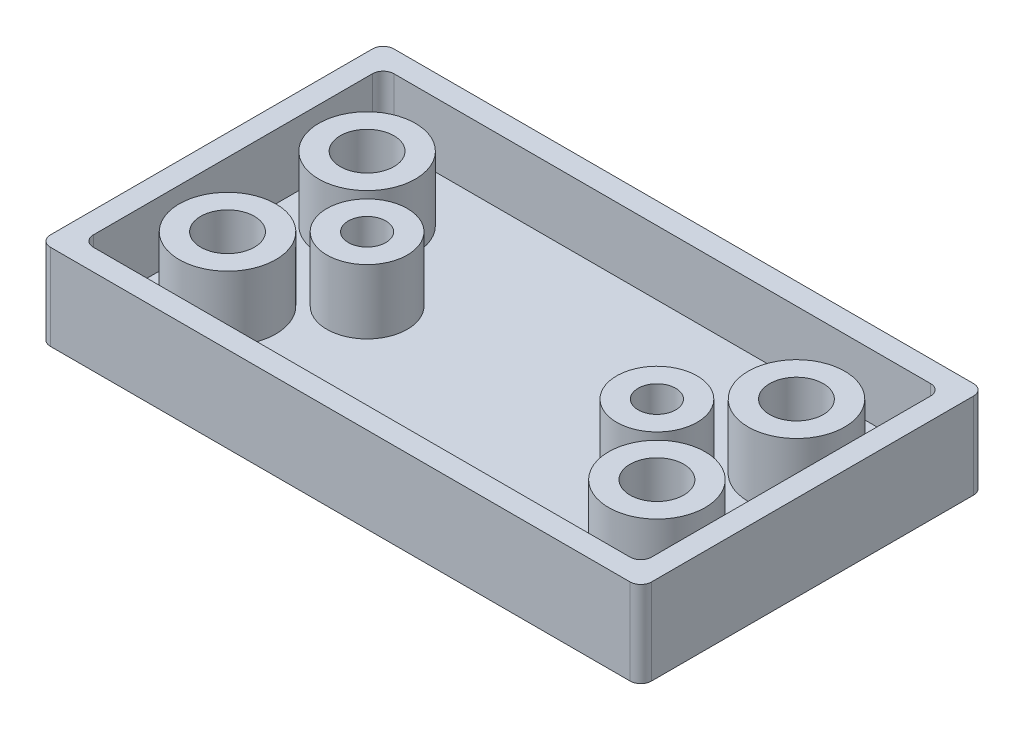
from build123d import *

# Parameters (mm, degrees)
SKETCH1_W                 = 56
SKETCH1_H                 = 32
SKETCH1_W_2               = 52
SKETCH1_H_2               = 28
BOSS_EXTRUDE1_DEPTH       = 8
SKETCH2_W                 = 56
SKETCH2_H                 = 32
BOSS_EXTRUDE2_DEPTH       = 2
SKETCH3_R                 = 3.75
SKETCH3_R_2               = 1.75
SKETCH3_R_3               = 4.5
SKETCH3_R_4               = 2.5
BOSS_EXTRUDE3_DEPTH       = 6
MIRROR2_COPY_1_SKETCH_R   = 3.75
MIRROR2_COPY_1_SKETCH_R_2 = 1.75
MIRROR2_COPY_1_SKETCH_R_3 = 4.5
MIRROR2_COPY_1_SKETCH_R_4 = 2.5
MIRROR2_COPY_1_DEPTH      = 6
FILLET1_R                 = 1


with BuildPart() as part:
    # Sketch1 → Boss-Extrude1 (new body)
    with BuildSketch(Plane(origin=(0, 0, 0), x_dir=(1, 0, 0), z_dir=(0, 1, 0))):
        Rectangle(SKETCH1_W, SKETCH1_H)
        Rectangle(SKETCH1_W_2, SKETCH1_H_2, mode=Mode.SUBTRACT)
    extrude(amount=BOSS_EXTRUDE1_DEPTH)

    # Sketch2 → Boss-Extrude2 (add)
    with BuildSketch(Plane(origin=(0, 0, 0), x_dir=(1, 0, 0), z_dir=(0, 1, 0))):
        Rectangle(SKETCH2_W, SKETCH2_H)
    extrude(amount=BOSS_EXTRUDE2_DEPTH)

    # Sketch3 → Boss-Extrude3 (add)
    # profile 1 of 2: a face of its own
    with BuildSketch(Plane(origin=(0, 2, 0), x_dir=(1, 0, 0), z_dir=(0, 1, 0))):
        with Locations(Location((13.5, 0, 0), (0, 0, 270))):
            Circle(SKETCH3_R)
        with Locations(Location((13.5, 0, 0), (0, 0, 270))):
            Circle(SKETCH3_R_2, mode=Mode.SUBTRACT)
    # profile 2 of 2: a face of its own
    with BuildSketch(Plane(origin=(0, 2, 0), x_dir=(1, 0, 0), z_dir=(0, 1, 0))):
        with Locations(Location((20, 6.5, 0), (0, 0, 270))):
            Circle(SKETCH3_R_3)
        with Locations(Location((20, 6.5, 0), (0, 0, 270))):
            Circle(SKETCH3_R_4, mode=Mode.SUBTRACT)
    boss_extrude3 = extrude(amount=BOSS_EXTRUDE3_DEPTH)

    # Mirror1: Boss-Extrude3 across plane
    add(boss_extrude3.mirror(Plane.XY))

    # Mirror2: Boss-Extrude3 across plane
    add(boss_extrude3.mirror(Plane(origin=(0, 0, 0), x_dir=(0, 0, 1), z_dir=(1, 0, 0))))

    # Mirror2 copy 1 sketch → Mirror2 copy 1 (add)
    # profile 1 of 2: a face of its own
    with BuildSketch(Plane(origin=(0, 2, 0), x_dir=(-1, 0, 0), z_dir=(0, 1, 0))):
        with Locations(Location((13.5, 0, 0), (0, 0, 270))):
            Circle(MIRROR2_COPY_1_SKETCH_R)
        with Locations(Location((13.5, 0, 0), (0, 0, 270))):
            Circle(MIRROR2_COPY_1_SKETCH_R_2, mode=Mode.SUBTRACT)
    # profile 2 of 2: a face of its own
    with BuildSketch(Plane(origin=(0, 2, 0), x_dir=(-1, 0, 0), z_dir=(0, 1, 0))):
        with Locations(Location((20, 6.5, 0), (0, 0, 270))):
            Circle(MIRROR2_COPY_1_SKETCH_R_3)
        with Locations(Location((20, 6.5, 0), (0, 0, 270))):
            Circle(MIRROR2_COPY_1_SKETCH_R_4, mode=Mode.SUBTRACT)
    extrude(amount=MIRROR2_COPY_1_DEPTH)

    # Fillet1
    fillet1_edges = [part.edges().sort_by_distance(p)[0] for p in [
        (26, 5, 14),
        (26, 5, -14),
        (-26, 5, -14),
        (-26, 5, 14),
        (-28, 4, 16),
        (-28, 4, -16),
        (28, 4, -16),
        (28, 4, 16),
    ]]
    fillet(fillet1_edges, radius=FILLET1_R)


solid = part.part
